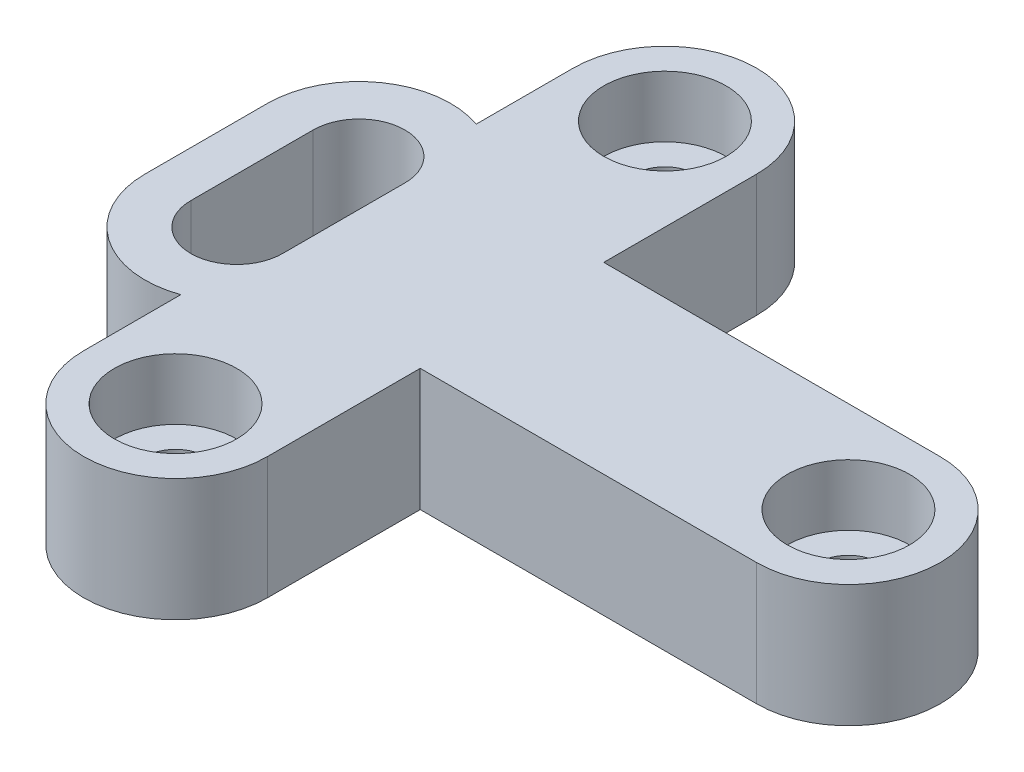
from build123d import *

# Parameters (mm, degrees)
SKETCH1_R           = 5
BOSS_EXTRUDE1_DEPTH = 10
SKETCH2_R           = 10
CUT_EXTRUDE1_DEPTH  = 10


with BuildPart() as part:
    # Sketch1 → Boss-Extrude1 (new, symmetric)
    with BuildSketch(Plane(origin=(0, 0, 0), x_dir=(1, 0, 0), z_dir=(0, 1, 0))):
        with BuildLine():
            Line((35, -40), (35, -15))
            Line((35, -15), (90, -15))
            ThreePointArc((90, -15), (105, 0), (90, 15))
            Line((90, 15), (35, 15))
            Line((35, 15), (35, 40))
            ThreePointArc((35, 40), (20, 55), (5, 40))
            Line((5, 40), (5, 24.142135624))
            ThreePointArc((5, 24.142135624), (-8.660254038, 22.247448714), (-15, 10))
            Line((-15, 10), (-15, -10))
            ThreePointArc((-15, -10), (-8.660254038, -22.247448714), (5, -24.142135624))
            Line((5, -24.142135624), (5, -40))
            ThreePointArc((5, -40), (20, -55), (35, -40))
        make_face()
        with Locations(Location((20, -40, 0), (0, 0, 270))):
            Circle(SKETCH1_R, mode=Mode.SUBTRACT)
        with Locations(Location((20, 40, 0), (0, 0, 270))):
            Circle(SKETCH1_R, mode=Mode.SUBTRACT)
        with Locations(Location((90, 0, 0), (0, 0, 270))):
            Circle(SKETCH1_R, mode=Mode.SUBTRACT)
        with BuildLine():
            Line((7.5, 10), (7.5, -10))
            ThreePointArc((7.5, -10), (0, -17.5), (-7.5, -10))
            Line((-7.5, -10), (-7.5, 10))
            ThreePointArc((-7.5, 10), (0, 17.5), (7.5, 10))
        make_face(mode=Mode.SUBTRACT)
    extrude(amount=BOSS_EXTRUDE1_DEPTH, both=True)

    # Sketch2 → Cut-Extrude1 (cut)
    with BuildSketch(Plane(origin=(0, 10, 0), x_dir=(1, 0, 0), z_dir=(0, 1, 0))):
        with Locations(Location((20, -40, 0), (0, 0, 270))):
            Circle(SKETCH2_R)
        with Locations(Location((20, 40, 0), (0, 0, 270))):
            Circle(SKETCH2_R)
        with Locations(Location((90, 0, 0), (0, 0, 270))):
            Circle(SKETCH2_R)
    extrude(amount=-CUT_EXTRUDE1_DEPTH, mode=Mode.SUBTRACT)


solid = part.part
